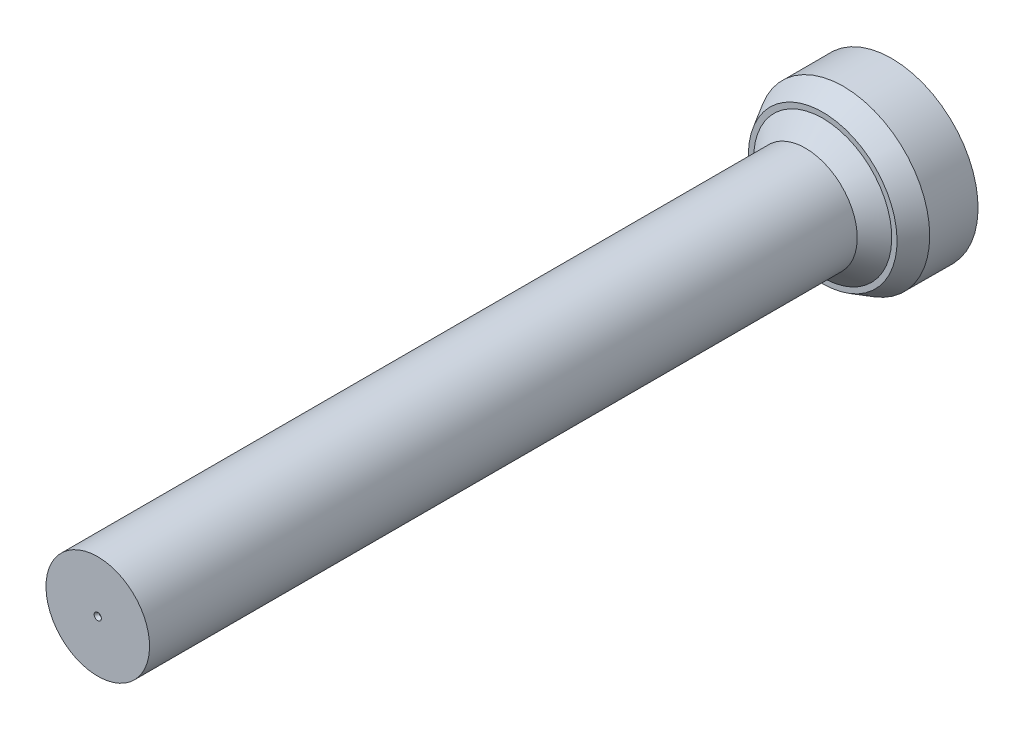
from build123d import *

# Parameters (mm, degrees)
FASE1_SIZE  = 6
FASE1_SIZE2 = 3.464101615


with BuildPart() as part:
    # Skizze1 → Rotation1 (revolve)
    with BuildSketch(Plane(origin=(0, 0, 0), x_dir=(0, 0, -1), z_dir=(1, 0, 0))):
        Polygon((115, 0), (115, 25), (95, 25), (95, 20), (90, 15), (-115, 15), (-115, 0), align=None)
    revolve(axis=Axis((0, 0, -115), (0, 0, 1)))

    # Fase1
    fase1_edges = [part.edges().sort_by_distance(p)[0] for p in [
        (0, -25, -95),
    ]]
    fase1_side = [part.faces().sort_by_distance(p)[0] for p in [
        (0, -25, -105),
    ]]
    chamfer(fase1_edges, length=FASE1_SIZE, length2=FASE1_SIZE2, reference=fase1_side[0])

    # Skizze3 → Schnitt-Rotation1 (revolve, cut)
    with BuildSketch(Plane(origin=(0, 0, 115), x_dir=(1, 0, 0), z_dir=(0, -1, 0))):
        Polygon((0, -2.20043031), (0.5, -1.9), (0.5, -0.969948452), (1.06, 0), (0, 0), align=None)
    revolve(axis=Axis((0, 0, 115), (0, 0, -1)), mode=Mode.SUBTRACT)


solid = part.part
